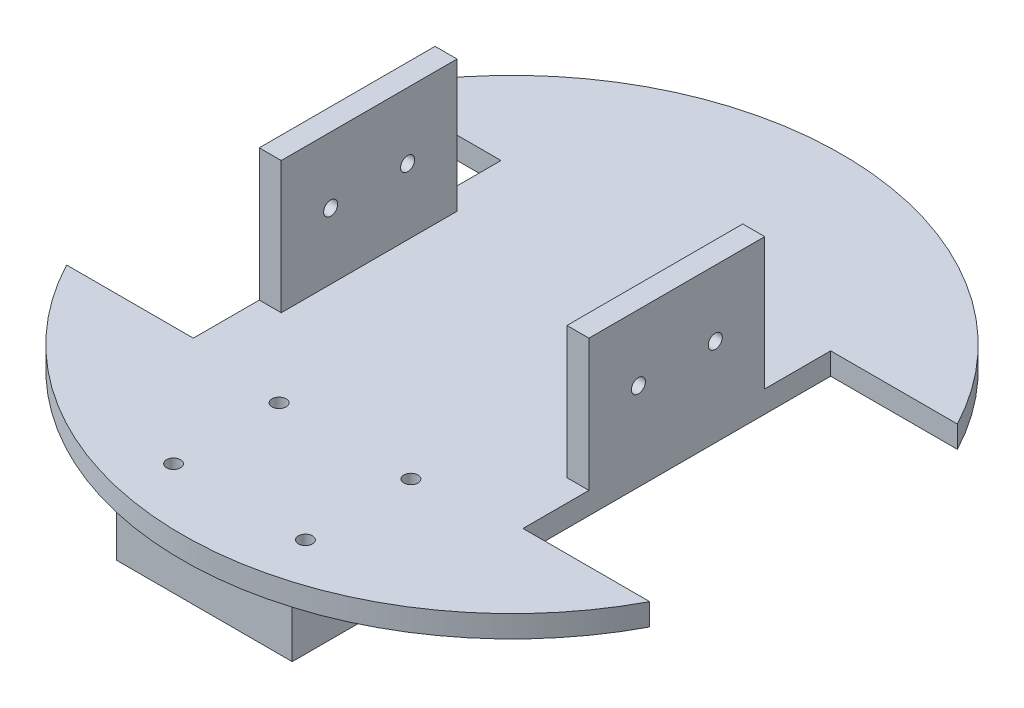
from build123d import *

# Parameters (mm, degrees)
SKETCH1_R           = 75
BOSS_EXTRUDE2_DEPTH = 5
SKETCH5_W           = 35
SKETCH5_H           = 70
CUT_EXTRUDE1_DEPTH  = 107.183802908
SKETCH6_W           = 5
SKETCH6_H           = 40
BOSS_EXTRUDE3_DEPTH = 30
SKETCH7_R           = 1.6
CUT_EXTRUDE2_DEPTH  = 136.669635512
SKETCH8_W           = 40
SKETCH8_H           = 40
BOSS_EXTRUDE5_DEPTH = 12.5
SKETCH9_R           = 1.6
CUT_EXTRUDE3_DEPTH  = 111.820801297


with BuildPart() as part:
    # Sketch1 → Boss-Extrude2 (new body)
    with BuildSketch(Plane(origin=(0, 0, 0), x_dir=(1, 0, 0), z_dir=(0, 1, 0))):
        with Locations(Location((0, 0, 0), (0, 0, 270))):
            Circle(SKETCH1_R)
    extrude(amount=BOSS_EXTRUDE2_DEPTH)

    # Sketch5 → Cut-Extrude1 (cut, through all)
    with BuildSketch(Plane(origin=(0, 5, 0), x_dir=(1, 0, 0), z_dir=(0, 1, 0))):
        with Locations((55, 0)):
            Rectangle(SKETCH5_W, SKETCH5_H)
        with Locations((-55, 0)):
            Rectangle(SKETCH5_W, SKETCH5_H)
    extrude(amount=-CUT_EXTRUDE1_DEPTH, mode=Mode.SUBTRACT)


with BuildPart() as cut_extrude1_piece_1:
    # of the separate pieces the step leaves, piece 1, a body of its own (cut_extrude1_pieces)
    add(part.part.solids().sort_by_distance((-66.332495807, 0, 35))[0])

    # Sketch6 → Boss-Extrude3 (add)
    with BuildSketch(Plane(origin=(0, 5, 0), x_dir=(1, 0, 0), z_dir=(0, 1, 0))):
        with Locations((-35, 0)):
            Rectangle(SKETCH6_W, SKETCH6_H)
    boss_extrude3 = extrude(amount=BOSS_EXTRUDE3_DEPTH)

    # Sketch7 → Cut-Extrude2 (cut, through all)
    with BuildSketch(Plane(origin=(-32.5, 0, 0), x_dir=(0, 0, -1), z_dir=(1, 0, 0))):
        with Locations((-8.75, 20)):
            Circle(SKETCH7_R)
        with Locations((8.75, 20)):
            Circle(SKETCH7_R)
    cut_extrude2 = extrude(amount=-CUT_EXTRUDE2_DEPTH, mode=Mode.SUBTRACT)

    # Mirror1: Boss-Extrude3, Cut-Extrude2 across plane
    add(boss_extrude3.mirror(Plane(origin=(0, 0, 0), x_dir=(0, 0, 1), z_dir=(1, 0, 0))))
    add(cut_extrude2.mirror(Plane(origin=(0, 0, 0), x_dir=(0, 0, 1), z_dir=(1, 0, 0))), mode=Mode.SUBTRACT)

    # Sketch8 → Boss-Extrude5 (add)
    with BuildSketch(Plane.XZ):
        with Locations((0, 50)):
            Rectangle(SKETCH8_W, SKETCH8_H)
    extrude(amount=BOSS_EXTRUDE5_DEPTH)

    # Sketch9 → Cut-Extrude3 (cut, through all)
    with BuildSketch(Plane.XZ.offset(12.5)):
        with Locations(Location((-15, 62, 0), (0, 0, 270))):
            Circle(SKETCH9_R)
        with Locations(Location((15, 62, 0), (0, 0, 270))):
            Circle(SKETCH9_R)
        with Locations(Location((-15, 38, 0), (0, 0, 270))):
            Circle(SKETCH9_R)
        with Locations(Location((15, 38, 0), (0, 0, 270))):
            Circle(SKETCH9_R)
    extrude(amount=-CUT_EXTRUDE3_DEPTH, mode=Mode.SUBTRACT)


with BuildPart() as cut_extrude1_piece_2:
    # of the separate pieces the step leaves, piece 2, a body of its own (cut_extrude1_pieces)
    add(part.part.solids().sort_by_distance((-72.5, 0, -19.20286437))[0])


with BuildPart() as cut_extrude1_piece_3:
    # of the separate pieces the step leaves, piece 3, a body of its own (cut_extrude1_pieces)
    add(part.part.solids().sort_by_distance((72.5, 0, 19.20286437))[0])


solid = cut_extrude1_piece_1.part
